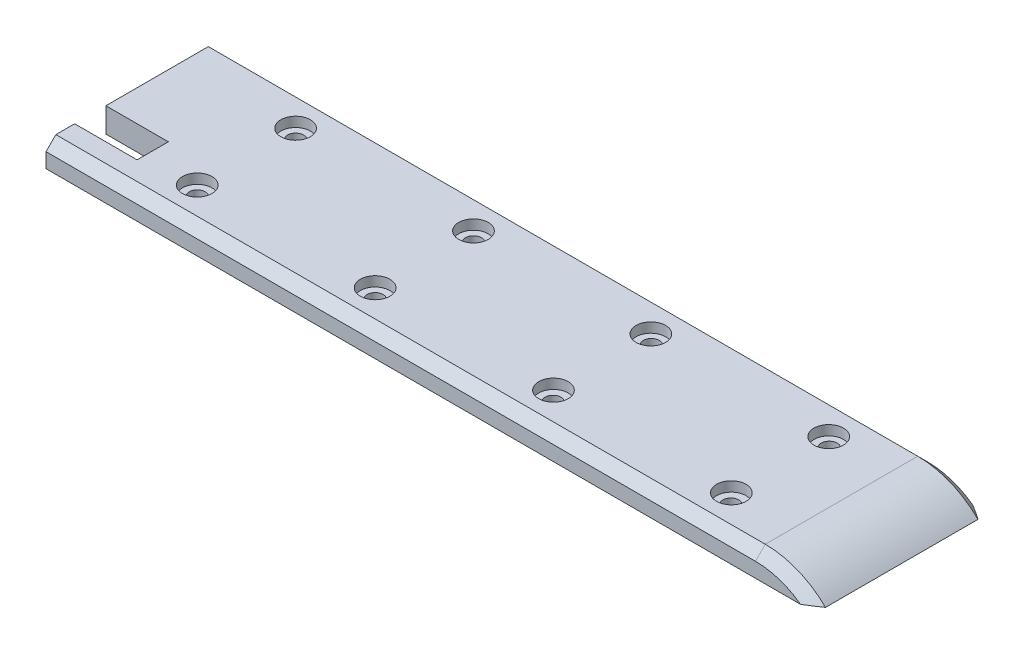
from build123d import *

# Parameters (mm, degrees)
BOSS_EXTRUDE1_DEPTH = 17.5
SKETCH2_W           = 18
SKETCH2_H           = 5
CUT_EXTRUDE1_DEPTH  = 17.5
SKETCH3_R           = 1.625
CUT_EXTRUDE2_DEPTH  = 5
SKETCH4_R           = 3
CUT_EXTRUDE3_DEPTH  = 2
CHAMFER1_SIZE       = 2
SKETCH5_W           = 12.7
SKETCH5_H           = 6.35
CUT_EXTRUDE4_DEPTH  = 5


with BuildPart() as part:
    # Sketch1 → Boss-Extrude1 (new, symmetric)
    with BuildSketch(Plane.XY):
        with BuildLine():
            Line((-75, 17.5), (75, 17.5))
            ThreePointArc((75, 17.5), (81.614378278, 16.201851746), (87.247448714, 12.5))
            Line((87.247448714, 12.5), (-87.247448714, 12.5))
            ThreePointArc((-87.247448714, 12.5), (-81.614378278, 16.201851746), (-75, 17.5))
        make_face()
    extrude(amount=BOSS_EXTRUDE1_DEPTH, both=True)

    # Sketch2 → Cut-Extrude1 (cut, symmetric)
    with BuildSketch(Plane.XY):
        with Locations((-78.247448714, 15)):
            Rectangle(SKETCH2_W, SKETCH2_H)
    extrude(amount=CUT_EXTRUDE1_DEPTH, both=True, mode=Mode.SUBTRACT)

    # Sketch3 → Cut-Extrude2 (cut)
    with BuildSketch(Plane.XZ.offset(-12.5)):
        with Locations((-46, -10)):
            Circle(SKETCH3_R)
        with Locations((-9.833333333, -10)):
            Circle(SKETCH3_R)
        with Locations((26.333333333, -10)):
            Circle(SKETCH3_R)
        with Locations((62.5, -10)):
            Circle(SKETCH3_R)
    cut_extrude2 = extrude(amount=-CUT_EXTRUDE2_DEPTH, mode=Mode.SUBTRACT)

    # Sketch4 → Cut-Extrude3 (cut)
    with BuildSketch(Plane(origin=(0, 17.5, 0), x_dir=(1, 0, 0), z_dir=(0, 1, 0))):
        with Locations(Location((62.5, 9.9, 0), (0, 0, 180))):
            Circle(SKETCH4_R)
        with Locations(Location((26.333333333, 9.9, 0), (0, 0, 180))):
            Circle(SKETCH4_R)
        with Locations(Location((-9.833333333, 10, 0), (0, 0, 180))):
            Circle(SKETCH4_R)
        with Locations(Location((-46, 10, 0), (0, 0, 180))):
            Circle(SKETCH4_R)
    cut_extrude3 = extrude(amount=-CUT_EXTRUDE3_DEPTH, mode=Mode.SUBTRACT)

    # Mirror1: Cut-Extrude2, Cut-Extrude3 across plane
    add(cut_extrude2.mirror(Plane.XY), mode=Mode.SUBTRACT)
    add(cut_extrude3.mirror(Plane.XY), mode=Mode.SUBTRACT)

    # Chamfer1
    chamfer1_edges = [part.edges().sort_by_distance(p)[0] for p in [
        (81.614378278, 16.201851746, 17.5),
        (2.876275643, 17.5, 17.5),
        (2.876275643, 17.5, -17.5),
        (81.614378278, 16.201851746, -17.5),
    ]]
    chamfer(chamfer1_edges, length=CHAMFER1_SIZE)

    # Sketch5 → Cut-Extrude4 (cut)
    with BuildSketch(Plane(origin=(0, 17.5, 0), x_dir=(1, 0, 0), z_dir=(0, 1, 0))):
        with Locations((-62.897448714, -8.5)):
            Rectangle(SKETCH5_W, SKETCH5_H)
    extrude(amount=-CUT_EXTRUDE4_DEPTH, mode=Mode.SUBTRACT)


solid = part.part
